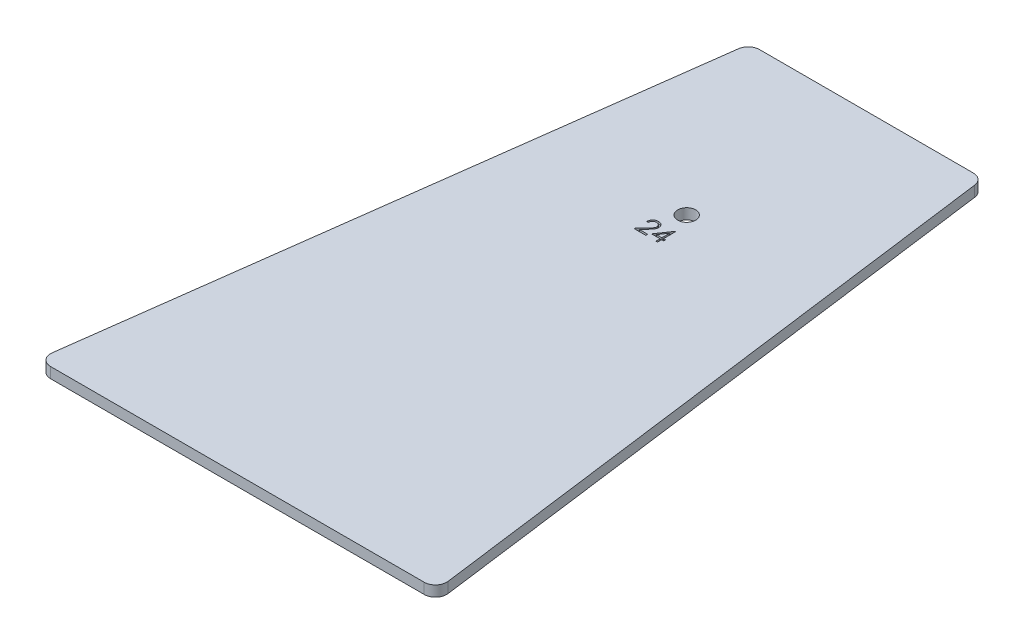
from build123d import *

# Parameters (mm, degrees)
BOSS_EXTRUDE1_DEPTH = 5.9944
SKETCH2_R           = 5.08
CUT_EXTRUDE1_DEPTH  = 374.126902856
CUT_EXTRUDE2_DEPTH  = 1.27
FILLET1_R           = 6.35


with BuildPart() as part:
    # Sketch1 → Boss-Extrude1 (new body)
    with BuildSketch(Plane(origin=(0, 0, 0), x_dir=(1, 0, 0), z_dir=(0, 1, 0))):
        Polygon((-66.04, 0), (66.04, 0), (112.855628142, -355.6), (-112.855628142, -355.6), align=None)
    extrude(amount=BOSS_EXTRUDE1_DEPTH)

    # Sketch2 → Cut-Extrude1 (cut, through all)
    with BuildSketch(Plane(origin=(0, 5.9944, 0), x_dir=(1, 0, 0), z_dir=(0, 1, 0))):
        with Locations(Location((0, -101.6, 0), (0, 0, 270))):
            Circle(SKETCH2_R)
    extrude(amount=-CUT_EXTRUDE1_DEPTH, mode=Mode.SUBTRACT)

    # Sketch3 → Cut-Extrude2 (cut)
    # profile 1 of 2: a face of its own
    with BuildSketch(Plane(origin=(0, 5.9944, 0), x_dir=(1, 0, 0), z_dir=(0, 1, 0))):
        with BuildLine():
            Line((-7.226250791, -116.081432875), (-8.138045663, -116.081432875))
            add(Edge.make_bspline(
                [(-8.138045663, -116.081432875), (-8.13210307, -115.960468241), (-8.120431976, -115.722896918), (-8.065776142, -115.376516664), (-7.987570625, -115.045431877), (-7.876996575, -114.732300927), (-7.739673209, -114.434355132), (-7.574994044, -114.152777944), (-7.379939895, -113.888643522), (-7.158722633, -113.644400479), (-6.918457097, -113.420335988), (-6.659214713, -113.22684534), (-6.386796005, -113.063363186), (-6.102027464, -112.926693067), (-5.801696228, -112.824106543), (-5.488527704, -112.747988869), (-5.161145982, -112.702192391), (-4.938090375, -112.697269768), (-4.824648227, -112.694766208)],
                knots=[0, 0, 0, 0, 1.10065271, 2.161652631, 3.183658789, 4.190468796, 5.17591951, 6.163126047, 7.15150782, 8.156236427, 9.156009102, 10.134482811, 11.092018607, 12.041330605, 13.001268258, 13.972401359, 14.968799086, 16, 16, 16, 16], degree=3))
            add(Edge.make_bspline(
                [(-4.824648227, -112.694766208), (-4.713242161, -112.697374299), (-4.49433322, -112.702499104), (-4.174838915, -112.746509406), (-3.870685397, -112.815439466), (-3.582467195, -112.91214936), (-3.312483876, -113.042152155), (-3.058707267, -113.198318725), (-2.818116113, -113.378934007), (-2.601543278, -113.591579362), (-2.402674111, -113.818589713), (-2.231108708, -114.06094317), (-2.084185925, -114.311254468), (-1.961721117, -114.571432333), (-1.871569582, -114.843926518), (-1.803125412, -115.124769827), (-1.764437834, -115.416869279), (-1.758500262, -115.61457288), (-1.755481561, -115.715086721)],
                knots=[0, 0, 0, 0, 1.111607364, 2.184268762, 3.212621178, 4.221274766, 5.211760367, 6.196651075, 7.1921475, 8.207485113, 9.220403448, 10.201281604, 11.166441695, 12.114753415, 13.065576456, 14.026450734, 14.996634279, 16, 16, 16, 16], degree=3))
            add(Edge.make_bspline(
                [(-1.755481561, -115.715086721), (-1.760396861, -115.856594721), (-1.770141205, -116.137127455), (-1.853494938, -116.549376314), (-1.983677953, -116.948790353), (-2.140424566, -117.270244922), (-2.298550289, -117.529277006), (-2.441044311, -117.742546161), (-2.607856448, -117.972178035), (-2.801414602, -118.217403677), (-3.017714826, -118.480143905), (-3.258716305, -118.760239997), (-3.526137613, -119.054798048), (-3.713832004, -119.255982308), (-3.811090535, -119.360230952)],
                knots=[0, 0, 0, 0, 1.184426356, 2.348067706, 3.509069118, 4.696110526, 5.333549288, 6.050745305, 6.844228056, 7.710549037, 8.667450064, 9.695053472, 10.805634456, 12, 12, 12, 12], degree=3))
            Line((-3.811090535, -119.360230952), (-6.353125791, -122.073227747))
            Line((-6.353125791, -122.073227747), (-1.62522515, -122.073227747))
            Line((-1.62522515, -122.073227747), (-1.62522515, -123.115279029))
            Line((-1.62522515, -123.115279029), (-8.528814894, -123.115279029))
            Line((-8.528814894, -123.115279029), (-4.588558484, -118.910439285))
            add(Edge.make_bspline(
                [(-4.588558484, -118.910439285), (-4.492625189, -118.810295629), (-4.308356964, -118.617940162), (-4.04773097, -118.337109169), (-3.813647507, -118.076579074), (-3.604591304, -117.836842122), (-3.425097471, -117.614391628), (-3.265811221, -117.416432145), (-3.138185391, -117.234264941), (-2.999674414, -117.02310933), (-2.865521828, -116.765299861), (-2.750242531, -116.450242066), (-2.679950285, -116.125913812), (-2.671517963, -115.906742185), (-2.667276432, -115.796496977)],
                knots=[0, 0, 0, 0, 1.329631726, 2.553950428, 3.673215718, 4.687767853, 5.603093632, 6.413772471, 7.123043292, 7.734684054, 8.834405432, 9.900288307, 10.943827018, 12, 12, 12, 12], degree=3))
            add(Edge.make_bspline(
                [(-2.667276432, -115.796496977), (-2.669121901, -115.727172689), (-2.672758967, -115.59054783), (-2.704857883, -115.39023397), (-2.753366095, -115.197005824), (-2.822875758, -115.010269033), (-2.914625609, -114.831901083), (-3.026308335, -114.661684855), (-3.155166348, -114.497124887), (-3.304231747, -114.342828456), (-3.46798633, -114.201513871), (-3.640979923, -114.076330812), (-3.824005368, -113.971714421), (-4.01629098, -113.88595387), (-4.217300686, -113.818679049), (-4.42742326, -113.772063287), (-4.646078119, -113.742795276), (-4.795382209, -113.73883528), (-4.871459125, -113.73681749)],
                knots=[0, 0, 0, 0, 0.991446411, 1.95395049, 2.89581595, 3.838931463, 4.798493298, 5.75982156, 6.748411868, 7.785213223, 8.824556874, 9.840280684, 10.836137867, 11.835679398, 12.848801643, 13.863922112, 14.911575587, 16, 16, 16, 16], degree=3))
            add(Edge.make_bspline(
                [(-4.871459125, -113.73681749), (-4.950912742, -113.738893127), (-5.106946528, -113.742969334), (-5.336037206, -113.771483124), (-5.554581063, -113.820674478), (-5.763127844, -113.887953053), (-5.962030413, -113.973467012), (-6.150321467, -114.079977905), (-6.327578311, -114.207075131), (-6.494134162, -114.351174574), (-6.647590741, -114.511608525), (-6.782419386, -114.690453447), (-6.900228982, -114.884443887), (-7.003016928, -115.093056411), (-7.086490588, -115.318183955), (-7.150275505, -115.559027349), (-7.200747037, -115.814540845), (-7.217608343, -115.990991263), (-7.226250791, -116.081432875)],
                knots=[0, 0, 0, 0, 1.031018746, 2.02475058, 2.990194455, 3.934040569, 4.864654155, 5.795059489, 6.735614925, 7.690564532, 8.649604399, 9.611025574, 10.590972636, 11.591080095, 12.624614302, 13.701020113, 14.821632451, 16, 16, 16, 16], degree=3))
        make_face()
    # profile 2 of 2: a face of its own
    with BuildSketch(Plane(origin=(0, 5.9944, 0), x_dir=(1, 0, 0), z_dir=(0, 1, 0))):
        Polygon((4.832643439, -112.694766208), (5.017851773, -112.694766208), (5.017851773, -119.728612362), (6.190159465, -119.728612362), (6.190159465, -120.770663644), (5.017851773, -120.770663644), (5.017851773, -123.115279029), (4.106056901, -123.115279029), (4.106056901, -120.770663644), (-0.713430279, -120.770663644), align=None)
        Polygon((4.106056901, -119.728612362), (4.106056901, -115.316176465), (1.077595362, -119.728612362), align=None, mode=Mode.SUBTRACT)
    extrude(amount=-CUT_EXTRUDE2_DEPTH, mode=Mode.SUBTRACT)

    # Fillet1
    fillet1_edges = [part.edges().sort_by_distance(p)[0] for p in [
        (112.855628142, 2.9972, 355.6),
        (-112.855628142, 2.9972, 355.6),
        (-66.04, 2.9972, 0),
        (66.04, 2.9972, 0),
    ]]
    fillet(fillet1_edges, radius=FILLET1_R)


solid = part.part
